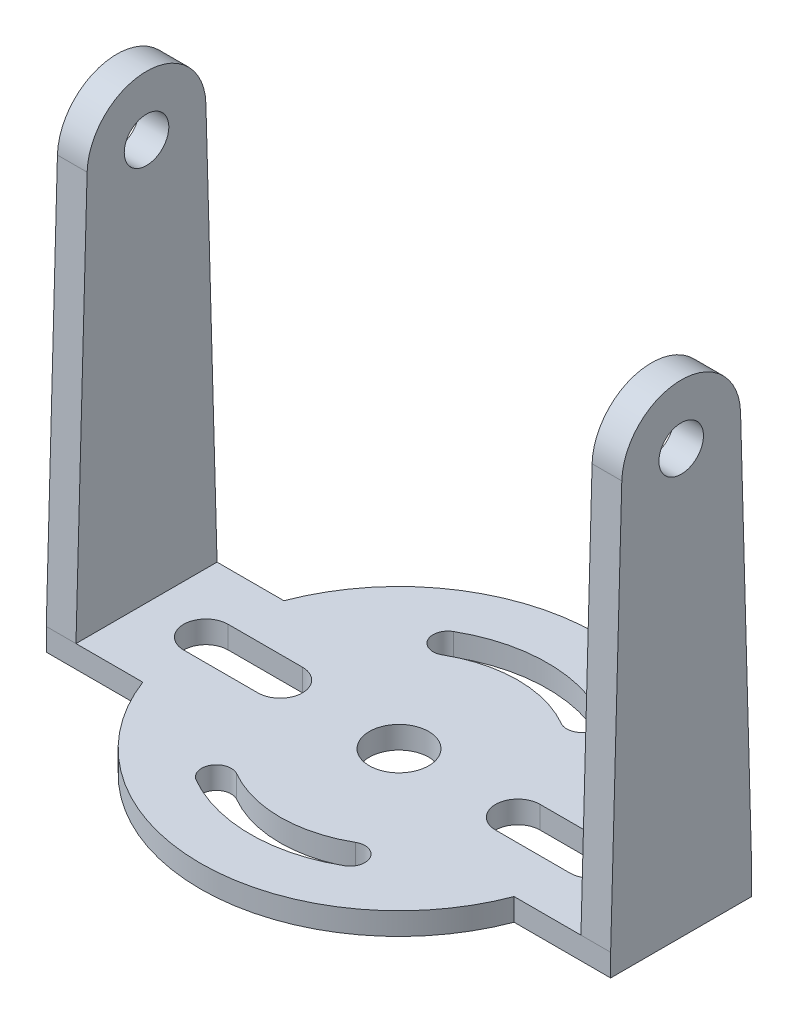
from build123d import *

# Parameters (mm, degrees)
EXTRUDE_1_DEPTH     = 38
EXTRUDE_2_DEPTH     = 1.5
SKETCH_3_W          = 34
SKETCH_3_H          = 9.5
CUT_EXTRUDE_1_DEPTH = 51.831215803
SKETCH_6_R          = 2
CUT_EXTRUDE_2_DEPTH = 1.5
CUT_EXTRUDE_3_REACH = 51.346
SKETCH_7_R          = 1.5


with BuildPart() as part:
    # 草图1 → 凸台-拉伸1 (new body)
    with BuildSketch(Plane(origin=(0, 0, 0), x_dir=(0, 0, -1), z_dir=(1, 0, 0))):
        with BuildLine():
            Line((-3.998463992, 0.110840888), (-4.75, -27))
            Line((-4.75, -27), (4.75, -27))
            Line((4.75, -27), (3.998463992, 0.110840888))
            ThreePointArc((3.998463992, 0.110840888), (0, 4), (-3.998463992, 0.110840888))
        make_face()
    extrude(amount=EXTRUDE_1_DEPTH)

    # 草图4 → 凸台-拉伸2 (add)
    with BuildSketch(Plane.XZ.offset(27)):
        with BuildLine():
            Line((6.5, 4.75), (0, 4.75))
            Line((0, 4.75), (0, -4.75))
            Line((0, -4.75), (6.5, -4.75))
            ThreePointArc((6.5, -4.75), (19, -13.37207912), (31.5, -4.75))
            Line((31.5, -4.75), (38, -4.75))
            Line((38, -4.75), (38, 4.75))
            Line((38, 4.75), (31.5, 4.75))
            ThreePointArc((31.5, 4.75), (19, 13.37207912), (6.5, 4.75))
        make_face()
    extrude(amount=EXTRUDE_2_DEPTH)

    # 草图3 → 切除-拉伸1 (cut, through all)
    with BuildSketch(Plane.XZ.offset(27)):
        with Locations((19, 0)):
            Rectangle(SKETCH_3_W, SKETCH_3_H)
    extrude(amount=-CUT_EXTRUDE_1_DEPTH, mode=Mode.SUBTRACT)

    # 草图6 → 切除-拉伸2 (cut)
    with BuildSketch(Plane.XZ.offset(28.5)):
        with Locations(Location((19, 0, 0), (0, 0, 270))):
            Circle(SKETCH_6_R)
        with BuildLine():
            Line((6, 1.5), (11, 1.5))
            ThreePointArc((11, 1.5), (12.5, 0), (11, -1.5))
            Line((11, -1.5), (6, -1.5))
            ThreePointArc((6, -1.5), (4.5, 0), (6, 1.5))
        make_face()
        with BuildLine():
            Line((32, 1.5), (27, 1.5))
            ThreePointArc((27, 1.5), (25.5, 0), (27, -1.5))
            Line((27, -1.5), (32, -1.5))
            ThreePointArc((32, -1.5), (33.5, 0), (32, 1.5))
        make_face()
        with BuildLine():
            ThreePointArc((24, 8.660254038), (19, 10), (14, 8.660254038))
            ThreePointArc((14, 8.660254038), (13.633974596, 7.294228634), (15, 6.92820323))
            ThreePointArc((15, 6.92820323), (19, 8), (23, 6.92820323))
            ThreePointArc((23, 6.92820323), (24.366025404, 7.294228634), (24, 8.660254038))
        make_face()
        with BuildLine():
            ThreePointArc((24, -8.660254038), (24.366025404, -7.294228634), (23, -6.92820323))
            ThreePointArc((23, -6.92820323), (19, -8), (15, -6.92820323))
            ThreePointArc((15, -6.92820323), (13.633974596, -7.294228634), (14, -8.660254038))
            ThreePointArc((14, -8.660254038), (19, -10), (24, -8.660254038))
        make_face()
    extrude(amount=-CUT_EXTRUDE_2_DEPTH, mode=Mode.SUBTRACT)

    # 切除-拉伸3: up to this face of the body (flat: up to its plane)
    cut_extrude_3_end = Plane(part.part.faces().sort_by_distance((38, -13.180930024, 0))[0])
    # 草图7 → 切除-拉伸3 (cut, up to the picked face)
    with BuildSketch(Plane.ZY, mode=Mode.PRIVATE) as cut_extrude_3_sk1:
        with Locations(Location((0, 0, 0), (0, 0, 180))):
            Circle(SKETCH_7_R)
    cut_extrude_3_tool1 = split(extrude(cut_extrude_3_sk1.sketch, amount=-CUT_EXTRUDE_3_REACH, mode=Mode.PRIVATE), bisect_by=cut_extrude_3_end, keep=Keep.BOTH, mode=Mode.PRIVATE)
    add(cut_extrude_3_tool1.solids().sort_by(Axis((0, 0, 0), (1, 0, 0)))[0], mode=Mode.SUBTRACT)


solid = part.part
